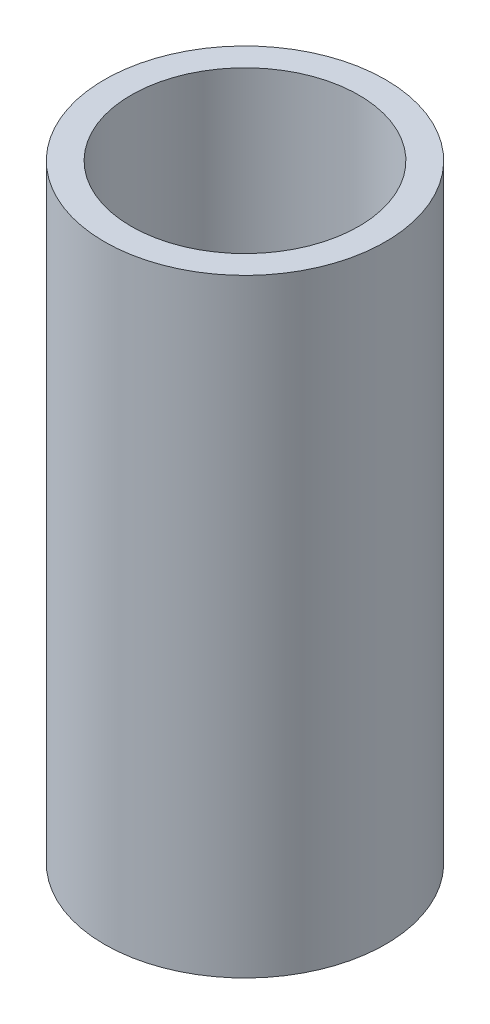
from build123d import *

# Parameters (mm, degrees)
SKETCH2_R           = 12.7
SKETCH2_R_2         = 10.287
BOSS_EXTRUDE1_DEPTH = 55


with BuildPart() as part:
    # Sketch2 → Boss-Extrude1 (new body)
    with BuildSketch(Plane(origin=(0, 0, 0), x_dir=(1, 0, 0), z_dir=(0, 1, 0))):
        with Locations(Location((0, 0, 0), (0, 0, 270))):
            Circle(SKETCH2_R)
        with Locations(Location((0, 0, 0), (0, 0, 270))):
            Circle(SKETCH2_R_2, mode=Mode.SUBTRACT)
    extrude(amount=BOSS_EXTRUDE1_DEPTH)


solid = part.part
